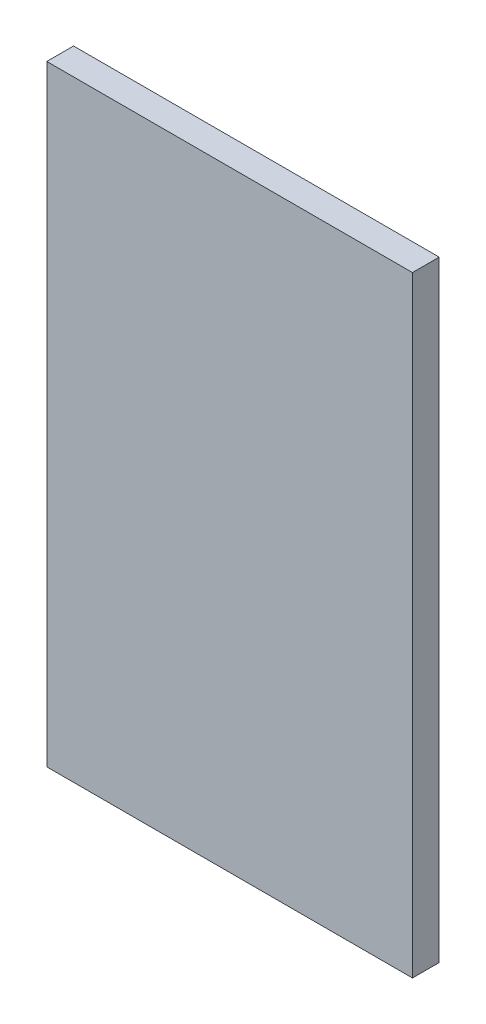
from build123d import *

# Parameters (mm, degrees)
SKETCH3_W           = 164
SKETCH3_H           = 274
BOSS_EXTRUDE2_DEPTH = 12


with BuildPart() as part:
    # Sketch3 → Boss-Extrude2 (new body)
    with BuildSketch(Plane.XY):
        with Locations((501, 67)):
            Rectangle(SKETCH3_W, SKETCH3_H)
    extrude(amount=BOSS_EXTRUDE2_DEPTH)


solid = part.part
